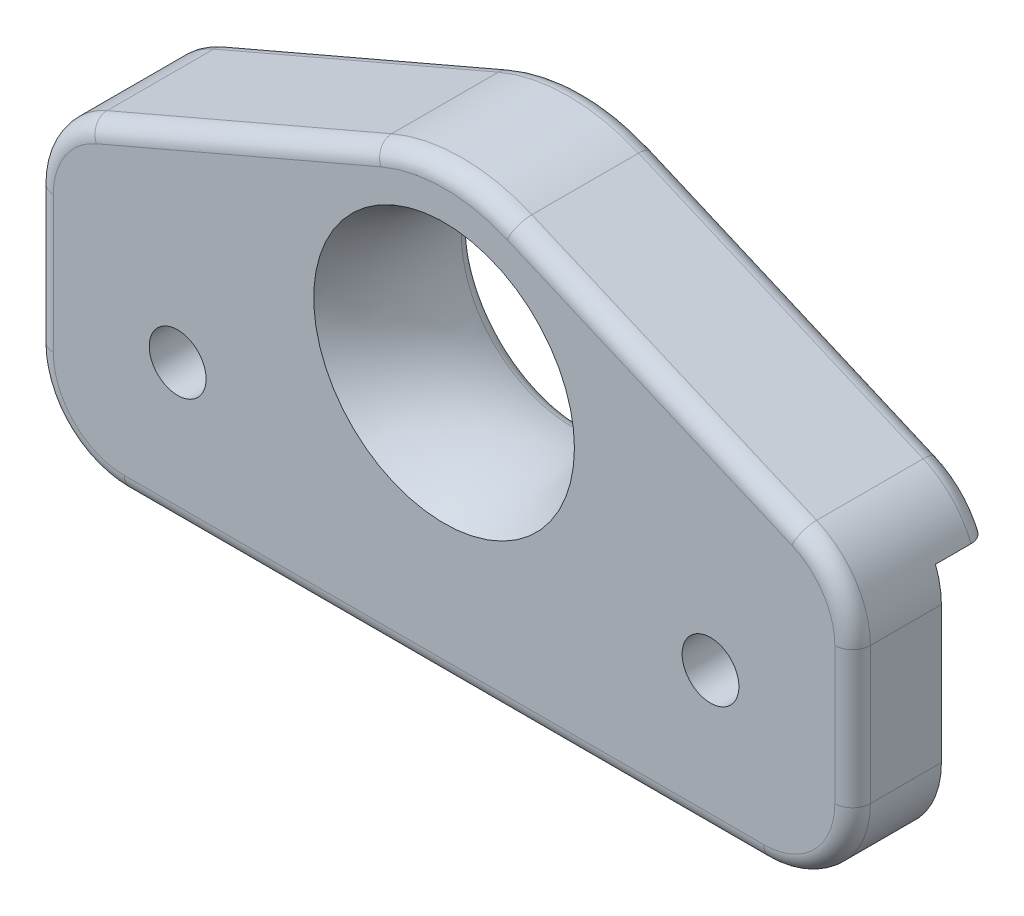
from build123d import *

# Parameters (mm, degrees)
ESQUISSE1_R             = 1.6
BOSS_EXTRU_1_DEPTH      = 8
ESQUISSE2_W             = 3
ESQUISSE2_H             = 14.5
ENL_V_MAT_EXTRU_1_DEPTH = 50.040799341
ESQUISSE5_R             = 8
BOSS_EXTRU_2_DEPTH      = 3
CONG_1_R                = 5
CONG_2_R                = 1


with BuildPart() as part:
    # Esquisse1 → Boss.-Extru.1 (new body)
    with BuildSketch(Plane.XY):
        with BuildLine():
            Line((-23, 1), (-3.948369031, 9.187512285))
            ThreePointArc((-3.948369031, 9.187512285), (0, 10), (3.948369031, 9.187512285))
            Line((3.948369031, 9.187512285), (23, 1))
            Line((23, 1), (23, -15))
            Line((23, -15), (-23, -15))
            Line((-23, -15), (-23, 1))
        make_face()
        with Locations((-15, -7)):
            Circle(ESQUISSE1_R, mode=Mode.SUBTRACT)
        with Locations(Location((15, -7, 0), (0, 0, 180))):
            Circle(ESQUISSE1_R, mode=Mode.SUBTRACT)
    extrude(amount=BOSS_EXTRU_1_DEPTH)

    # Esquisse2 → Enlèv. mat.-Extru.1 (cut, through all)
    with BuildSketch(Plane(origin=(23, 0, 0), x_dir=(0, 0, -1), z_dir=(1, 0, 0))):
        with Locations((-1.5, -7.75)):
            Rectangle(ESQUISSE2_W, ESQUISSE2_H)
    extrude(amount=-ENL_V_MAT_EXTRU_1_DEPTH, mode=Mode.SUBTRACT)

    # Esquisse5 → Boss.-Extru.2 (add)
    with BuildSketch(Plane(origin=(0, 0, 0), x_dir=(-1, 0, 0), z_dir=(0, 0, -1))):
        Circle(ESQUISSE5_R)
    extrude(amount=-BOSS_EXTRU_2_DEPTH)

    # Esquisse4 → Enlèvement de matière-Révolution1 (revolve, cut)
    with BuildSketch(Plane(origin=(0, 0, 0), x_dir=(0, 0, -1), z_dir=(1, 0, 0)), mode=Mode.PRIVATE) as enl_vement_de_mati_re_r_volution1_sk:
        with BuildLine():
            Line((-8, 0), (0, 0))
            Line((0, 0), (0, 6.460607986))
            ThreePointArc((0, 6.460607986), (-4.092346509, 6.059840087), (-8, 7.339745962))
            Line((-8, 7.339745962), (-8, 0))
        make_face()
    revolve(enl_vement_de_mati_re_r_volution1_sk.sketch.rotate(Axis((0, 0, 8), (0, 0, -1)), 90), axis=Axis((0, 0, 8), (0, 0, -1)), mode=Mode.SUBTRACT)

    # Congé1
    cong_1_edges = [part.edges().sort_by_distance(p)[0] for p in [
        (-23, -15, 5.5),
        (-23, 1, 4),
        (23, -15, 5.5),
        (23, 1, 4),
    ]]
    fillet(cong_1_edges, radius=CONG_1_R)

    # Congé2
    cong_2_edges = [part.edges().sort_by_distance(p)[0] for p in [
        (0, 10, 8),
        (-11.961276773, 5.743934112, 8),
        (-6.460607986, 0, 0),
        (-11.961276773, 5.743934112, 0),
        (0, -15, 8),
        (0, 10, 0),
        (-23, -6.146700103, 8),
        (23, -6.146700103, 8),
        (11.961276773, 5.743934112, 8),
        (22.175579156, 0.456970445, 8),
        (21.535533906, -13.535533906, 8),
        (-22.175579156, 0.456970445, 8),
        (-21.535533906, -13.535533906, 8),
        (11.961276773, 5.743934112, 0),
        (21.60386416, 1.17245656, 0),
        (-21.60386416, 1.17245656, 0),
    ]]
    fillet(cong_2_edges, radius=CONG_2_R)


solid = part.part
